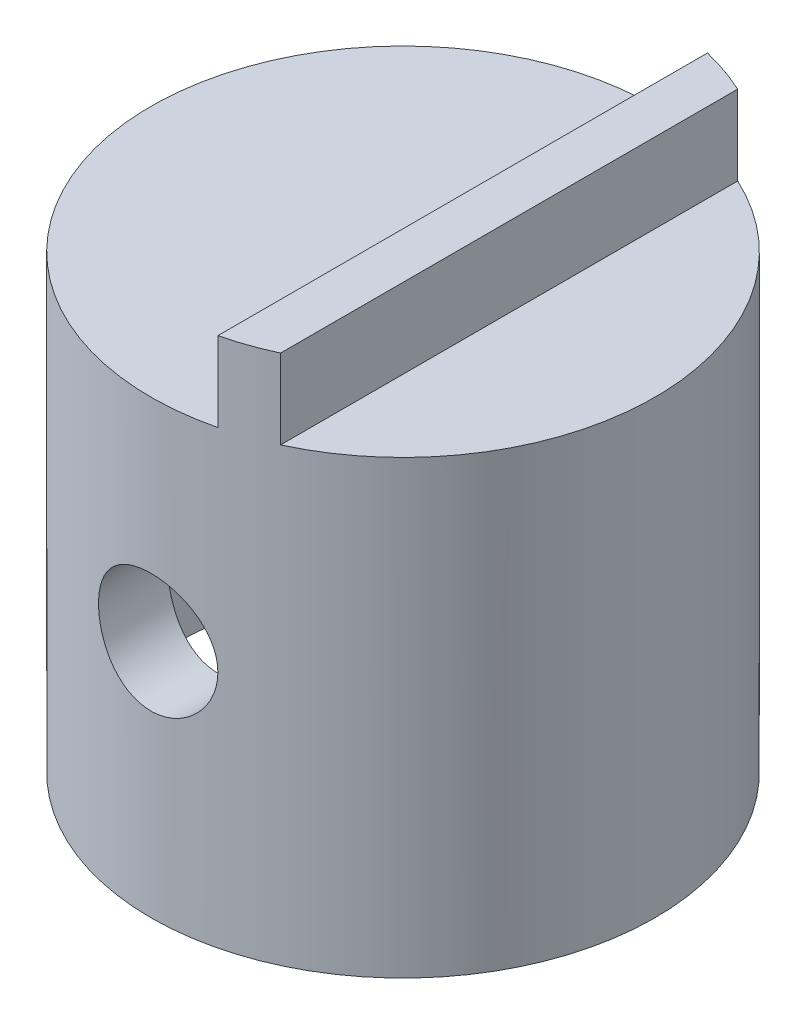
from build123d import *
from build123d.topology import SkipClean

# Parameters (mm, degrees)
ESQUISSE1_R                  = 9.5
BASE_EXTRUSION_DEPTH         = 17
BOSS_EXTRU_1_DEPTH           = 3
ENL_V_MAT_EXTRU_1_DEPTH      = 25.093567606
ENL_V_MAT_EXTRU_1_DEPTH_BACK = 25.093567606
ESQUISSE4_R                  = 2.25


with BuildPart() as part:
    # Esquisse1 → Base-Extrusion (new body)
    with BuildSketch(Plane(origin=(0, 0, 0), x_dir=(1, 0, 0), z_dir=(0, 1, 0))):
        with Locations(Location((0, 0, 0), (0, 0, 76.299766512))):
            Circle(ESQUISSE1_R)
    extrude(amount=BASE_EXTRUSION_DEPTH)

    # Esquisse2 → Boss.-Extru.1 (add)
    with SkipClean():  # the faces are left unmerged after this step: merging them gives an invalid solid
        with BuildSketch(Plane(origin=(0, 17, 0), x_dir=(-1, 0, 0), z_dir=(0, 1, 0))):
            with BuildLine():
                Line((-2.25, -9.229707471), (-2.25, 9.229707471))
                ThreePointArc((-2.25, 9.229707471), (-3.139988124, 8.966073532), (-4, 8.61684397))
                Line((-4, 8.61684397), (-4, -8.61684397))
                ThreePointArc((-4, -8.61684397), (-3.139988124, -8.966073532), (-2.25, -9.229707471))
            make_face()
        extrude(amount=BOSS_EXTRU_1_DEPTH)

    # Esquisse3 → Enlèvement de matière-Révolution1 (revolve, cut)
    with SkipClean():  # the faces are left unmerged after this step: merging them gives an invalid solid
        with BuildSketch(Plane.XY, mode=Mode.PRIVATE) as enl_vement_de_mati_re_r_volution1_sk:
            Polygon((8.5, 0), (8.5, 5), (7, 5), (7, 12.5), (8.5, 12.5), (8.5, 15), (0, 15), (0, 0), align=None)
        revolve(enl_vement_de_mati_re_r_volution1_sk.sketch.rotate(Axis((0, 0, 0), (0, 1, 0)), 90), axis=Axis((0, 0, 0), (0, 1, 0)), mode=Mode.SUBTRACT)

    # Esquisse4 → Enlèv. mat.-Extru.1 (cut, two sides: drawn at the far end of the back side and taken through both)
    with SkipClean():  # the faces are left unmerged after this step: merging them gives an invalid solid
        with BuildSketch(Plane.XY.offset(-ENL_V_MAT_EXTRU_1_DEPTH_BACK)):
            with Locations((0, 9)):
                Circle(ESQUISSE4_R)
        extrude(amount=ENL_V_MAT_EXTRU_1_DEPTH + ENL_V_MAT_EXTRU_1_DEPTH_BACK, mode=Mode.SUBTRACT)


solid = part.part
